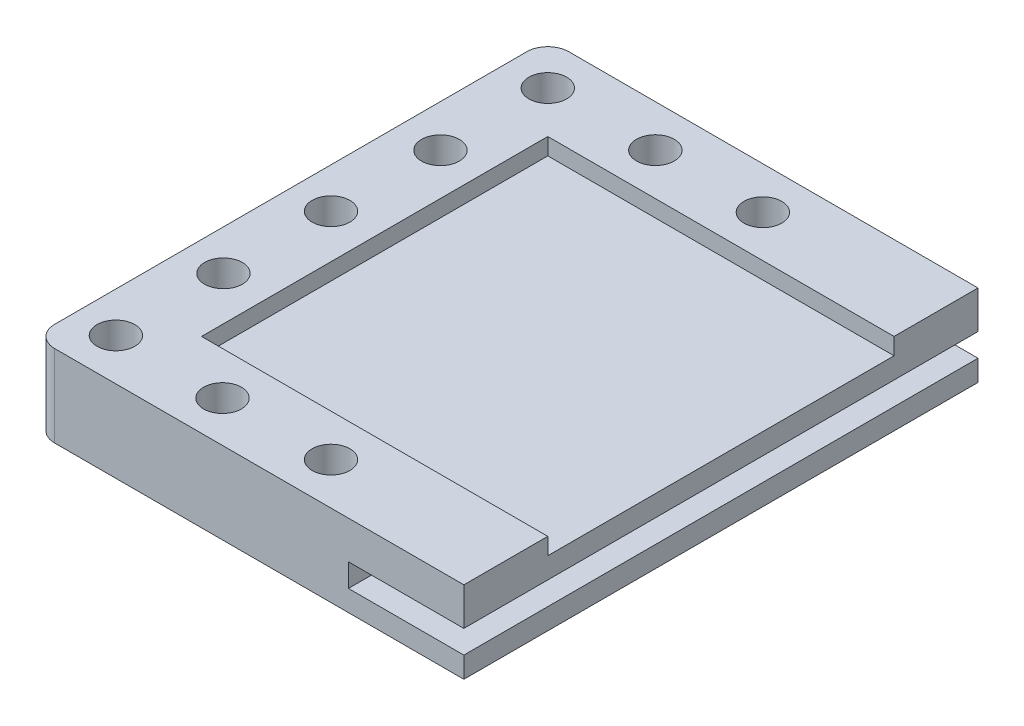
from build123d import *

# Parameters (mm, degrees)
SKETCH1_W                           = 20.5
SKETCH1_H                           = 24.5
BOSS_EXTRUDE1_DEPTH                 = 3.1
SKETCH2_W                           = 5.5
SKETCH2_H                           = 1.1
CUT_EXTRUDE1_DEPTH                  = 29.731142046
SKETCH3_W                           = 16.5
SKETCH3_H                           = 4
BOSS_EXTRUDE2_DEPTH                 = 0.8
TAP_DRILL_FOR_M2_5X0_45_TAP1_REACH  = 22.94
TAP_DRILL_FOR_M2_5X0_45_TAP1_BORE_R = 1.125
TAP_DRILL_FOR_M2X0_4_TAP2_D         = 1.8
FILLET2_R                           = 1


with BuildPart() as part:
    # Sketch1 → Boss-Extrude1 (new body)
    with BuildSketch(Plane(origin=(0, 0, 0), x_dir=(1, 0, 0), z_dir=(0, 1, 0))):
        with Locations((-4.433954619, -2.160858995)):
            Rectangle(SKETCH1_W, SKETCH1_H)
    extrude(amount=BOSS_EXTRUDE1_DEPTH)

    # Sketch2 → Cut-Extrude1 (cut, through all)
    with BuildSketch(Plane.XY.offset(14.410858995)):
        with Locations((3.066045381, 1.55)):
            Rectangle(SKETCH2_W, SKETCH2_H)
    extrude(amount=-CUT_EXTRUDE1_DEPTH, mode=Mode.SUBTRACT)

    # Sketch3 → Boss-Extrude2 (add)
    with BuildSketch(Plane(origin=(0, 3.1, 0), x_dir=(1, 0, 0), z_dir=(0, 1, 0))):
        Polygon((-10.683954619, 10.089141005), (-14.683954619, 10.089141005), (-14.683954619, -14.410858995), (-10.683954619, -14.410858995), (-10.683954619, -10.410858995), (-10.683954619, 6.089141005), align=None)
        with Locations((-2.433954619, 8.089141005)):
            Rectangle(SKETCH3_W, SKETCH3_H)
        with Locations((-2.433954619, -12.410858995)):
            Rectangle(SKETCH3_W, SKETCH3_H)
    extrude(amount=BOSS_EXTRUDE2_DEPTH)

    # Tap Drill for M2.5x0.45 Tap1 bore → Tap Drill for M2.5x0.45 Tap1 (cut, up to next)
    with BuildSketch(Plane(origin=(0, 0, 0), x_dir=(-1, 0, 0), z_dir=(0, -1, 0)), mode=Mode.PRIVATE) as tap_drill_for_m2_5x0_45_tap1_sk1:
        with Locations((-3.066045381, 5.339141005)):
            Circle(TAP_DRILL_FOR_M2_5X0_45_TAP1_BORE_R)
    tap_drill_for_m2_5x0_45_tap1_tool1 = extrude(tap_drill_for_m2_5x0_45_tap1_sk1.sketch, amount=-TAP_DRILL_FOR_M2_5X0_45_TAP1_REACH, mode=Mode.PRIVATE) & part.part
    # Tap Drill for M2.5x0.45 Tap1 bore → Tap Drill for M2.5x0.45 Tap1 (cut, up to next)
    with BuildSketch(Plane(origin=(0, 0, 0), x_dir=(-1, 0, 0), z_dir=(0, -1, 0)), mode=Mode.PRIVATE) as tap_drill_for_m2_5x0_45_tap1_sk2:
        with Locations((-3.066045381, 0.339141005)):
            Circle(TAP_DRILL_FOR_M2_5X0_45_TAP1_BORE_R)
    tap_drill_for_m2_5x0_45_tap1_tool2 = extrude(tap_drill_for_m2_5x0_45_tap1_sk2.sketch, amount=-TAP_DRILL_FOR_M2_5X0_45_TAP1_REACH, mode=Mode.PRIVATE) & part.part
    # Tap Drill for M2.5x0.45 Tap1 bore → Tap Drill for M2.5x0.45 Tap1 (cut, up to next)
    with BuildSketch(Plane(origin=(0, 0, 0), x_dir=(-1, 0, 0), z_dir=(0, -1, 0)), mode=Mode.PRIVATE) as tap_drill_for_m2_5x0_45_tap1_sk3:
        with Locations((-3.066045381, -4.660858995)):
            Circle(TAP_DRILL_FOR_M2_5X0_45_TAP1_BORE_R)
    tap_drill_for_m2_5x0_45_tap1_tool3 = extrude(tap_drill_for_m2_5x0_45_tap1_sk3.sketch, amount=-TAP_DRILL_FOR_M2_5X0_45_TAP1_REACH, mode=Mode.PRIVATE) & part.part
    # Tap Drill for M2.5x0.45 Tap1 bore → Tap Drill for M2.5x0.45 Tap1 (cut, up to next)
    with BuildSketch(Plane(origin=(0, 0, 0), x_dir=(-1, 0, 0), z_dir=(0, -1, 0)), mode=Mode.PRIVATE) as tap_drill_for_m2_5x0_45_tap1_sk4:
        with Locations((-3.046847319, -9.660822138)):
            Circle(TAP_DRILL_FOR_M2_5X0_45_TAP1_BORE_R)
    tap_drill_for_m2_5x0_45_tap1_tool4 = extrude(tap_drill_for_m2_5x0_45_tap1_sk4.sketch, amount=-TAP_DRILL_FOR_M2_5X0_45_TAP1_REACH, mode=Mode.PRIVATE) & part.part
    add(tap_drill_for_m2_5x0_45_tap1_tool1.solids().sort_by_distance((3.066045, 0, -5.339141))[0], mode=Mode.SUBTRACT)
    add(tap_drill_for_m2_5x0_45_tap1_tool2.solids().sort_by_distance((3.066045, 0, -0.339141))[0], mode=Mode.SUBTRACT)
    add(tap_drill_for_m2_5x0_45_tap1_tool3.solids().sort_by_distance((3.066045, 0, 4.660859))[0], mode=Mode.SUBTRACT)
    add(tap_drill_for_m2_5x0_45_tap1_tool4.solids().sort_by_distance((3.046847, 0, 9.660822))[0], mode=Mode.SUBTRACT)

    # Tap Drill for M2x0.4 Tap2 (through all)
    with Locations(Plane(origin=(0, 3.9, 0), x_dir=(1, 0, 0), z_dir=(0, 1, 0))):
        with Locations((-12.683954619, 8.089141005), (-12.674525688, 2.964141005), (-12.764705981, -2.160858995), (-12.764705981, -7.285858995), (-12.764705981, -12.410858995), (-7.558954619, 8.089141005), (-2.433954619, 8.089141005), (-2.514705981, -12.410858995), (-7.639705981, -12.456722912)):
            Hole(TAP_DRILL_FOR_M2X0_4_TAP2_D / 2)

    # Fillet2
    fillet2_edges = [part.edges().sort_by_distance(p)[0] for p in [
        (-14.683954619, 1.95, -10.089141005),
        (-14.683954619, 1.95, 14.410858995),
    ]]
    fillet(fillet2_edges, radius=FILLET2_R)


solid = part.part
